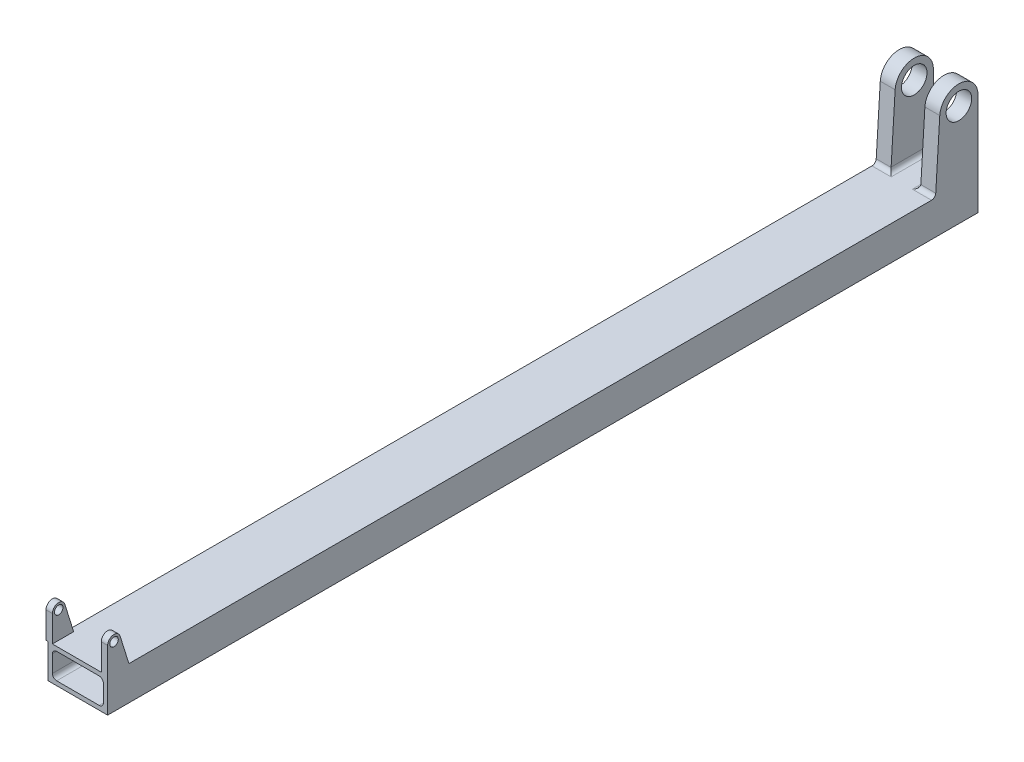
from build123d import *

# Parameters (mm, degrees)
SKETCH2_W           = 177.8
SKETCH2_H           = 101.6
SKETCH2_W_2         = 152.4
SKETCH2_H_2         = 76.2
BOSS_EXTRUDE2_DEPTH = 2600
SKETCH1_R           = 38.1
BOSS_EXTRUDE3_DEPTH = 44.45
BOSS_EXTRUDE5_START = -44.45
SKETCH3_R           = 38.1
BOSS_EXTRUDE5_DEPTH = 44.45
FILLET1_R           = 12.7
FILLET2_R           = 12.7
SKETCH5_R           = 12.7
BOSS_EXTRUDE7_DEPTH = 19.05
LPATTERN1_COUNT     = 2
LPATTERN1_PITCH     = 165.1


with BuildPart() as part:
    # Sketch2 → Boss-Extrude2 (new body)
    with BuildSketch(Plane.XY):
        with Locations((-88.9, 50.8)):
            Rectangle(SKETCH2_W, SKETCH2_H)
        with Locations((-88.9, 50.8)):
            Rectangle(SKETCH2_W_2, SKETCH2_H_2, mode=Mode.SUBTRACT)
    extrude(amount=BOSS_EXTRUDE2_DEPTH)

    # Sketch1 → Boss-Extrude3 (add)
    with BuildSketch(Plane(origin=(0, 0, 0), x_dir=(0, 0, -1), z_dir=(1, 0, 0))):
        with BuildLine():
            Line((-127, 101.6), (0, 101.6))
            Line((0, 101.6), (0, 304.8))
            ThreePointArc((0, 304.8), (-55.382017361, 361.922646449), (-114.190611982, 308.334272869))
            Line((-114.190611982, 308.334272869), (-127, 101.6))
        make_face()
        with Locations((-57.15, 304.8)):
            Circle(SKETCH1_R, mode=Mode.SUBTRACT)
    extrude(amount=-BOSS_EXTRUDE3_DEPTH)

    # Sketch3 → Boss-Extrude5 (add)
    with BuildSketch(Plane.ZY.offset(177.8).offset(BOSS_EXTRUDE5_START)):
        with BuildLine():
            Line((0, 304.8), (0, 101.6))
            Line((0, 101.6), (127, 101.6))
            Line((127, 101.6), (114.190611982, 308.334272869))
            ThreePointArc((114.190611982, 308.334272869), (55.382017361, 361.922646449), (0, 304.8))
        make_face()
        with Locations(Location((57.15, 304.8, 0), (0, 0, 180))):
            Circle(SKETCH3_R, mode=Mode.SUBTRACT)
    extrude(amount=BOSS_EXTRUDE5_DEPTH)

    # Fillet1
    fillet1_edges = [part.edges().sort_by_distance(p)[0] for p in [
        (-12.7, 88.9, 1300),
        (-165.1, 88.9, 1300),
        (-165.1, 12.7, 1300),
        (-12.7, 12.7, 1300),
    ]]
    fillet(fillet1_edges, radius=FILLET1_R)

    # Fillet2
    fillet2_edges = [part.edges().sort_by_distance(p)[0] for p in [
        (-44.45, 101.6, 63.5),
        (-22.225, 101.6, 127),
        (-133.35, 101.6, 63.5),
        (-155.575, 101.6, 127),
    ]]
    fillet(fillet2_edges, radius=FILLET2_R)

    # Sketch5 → Boss-Extrude7 (add)
    with BuildSketch(Plane(origin=(0, 0, 0), x_dir=(0, 0, -1), z_dir=(1, 0, 0))):
        with BuildLine():
            Line((-2600, 101.6), (-2600, 180.34))
            ThreePointArc((-2600, 180.34), (-2583.812295525, 199.173740052), (-2562.760129729, 185.999604185))
            Line((-2562.760129729, 185.999604185), (-2536.5, 101.6))
            Line((-2536.5, 101.6), (-2600, 101.6))
        make_face()
        with Locations((-2580.95, 180.34)):
            Circle(SKETCH5_R, mode=Mode.SUBTRACT)
    boss_extrude7 = extrude(amount=-BOSS_EXTRUDE7_DEPTH)

    # LPattern1: Boss-Extrude7 ×2
    with Locations(*[(-i * LPATTERN1_PITCH, 0, 0) for i in range(1, LPATTERN1_COUNT)]):
        add(boss_extrude7)


solid = part.part
